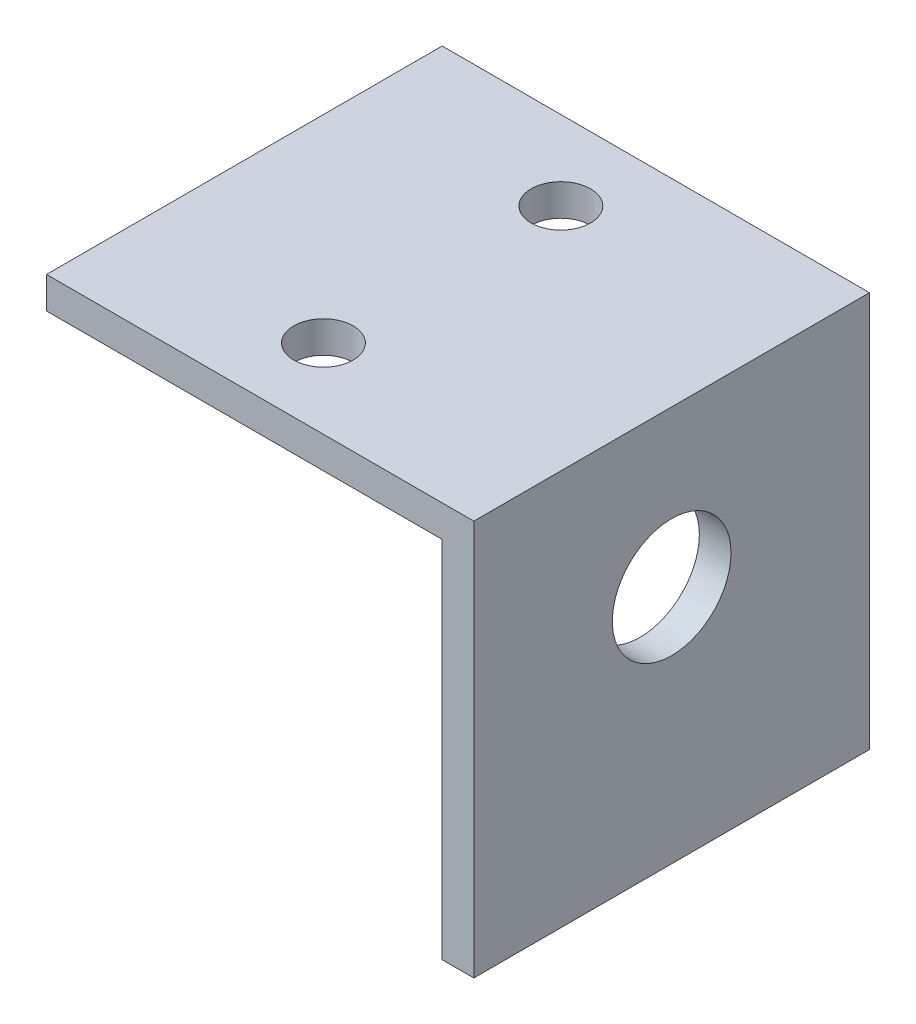
from build123d import *

# Parameters (mm, degrees)
SKETCH2_W           = 20
SKETCH2_H           = 20
BOSS_EXTRUDE1_DEPTH = 1.6
SKETCH2_4_W         = 1.6
SKETCH2_4_H         = 20
BOSS_EXTRUDE2_DEPTH = 20
SKETCH3_R           = 3
CUT_EXTRUDE1_DEPTH  = 3
SKETCH4_R           = 1.5
CUT_EXTRUDE2_DEPTH  = 2


with BuildPart() as part:
    # Sketch2 → Boss-Extrude1 (new body)
    with BuildSketch(Plane(origin=(0, 0, 0), x_dir=(1, 0, 0), z_dir=(0, 1, 0))):
        Rectangle(SKETCH2_W, SKETCH2_H)
    extrude(amount=-BOSS_EXTRUDE1_DEPTH)

    # Sketch2<4> → Boss-Extrude2 (add)
    with BuildSketch(Plane(origin=(0, 0, 0), x_dir=(1, 0, 0), z_dir=(0, 1, 0))):
        with Locations((10.8, 0)):
            Rectangle(SKETCH2_4_W, SKETCH2_4_H)
    extrude(amount=-BOSS_EXTRUDE2_DEPTH)

    # Sketch3 → Cut-Extrude1 (cut)
    with BuildSketch(Plane(origin=(11.6, 0, 0), x_dir=(0, 0, -1), z_dir=(1, 0, 0))):
        with Locations((0, -7.888677581)):
            Circle(SKETCH3_R)
    extrude(amount=-CUT_EXTRUDE1_DEPTH, mode=Mode.SUBTRACT)

    # Sketch4 → Cut-Extrude2 (cut)
    with BuildSketch(Plane(origin=(0, 0, 0), x_dir=(1, 0, 0), z_dir=(0, 1, 0))):
        with Locations((0, 6)):
            Circle(SKETCH4_R)
        with Locations((0, -6)):
            Circle(SKETCH4_R)
    extrude(amount=-CUT_EXTRUDE2_DEPTH, mode=Mode.SUBTRACT)


solid = part.part
